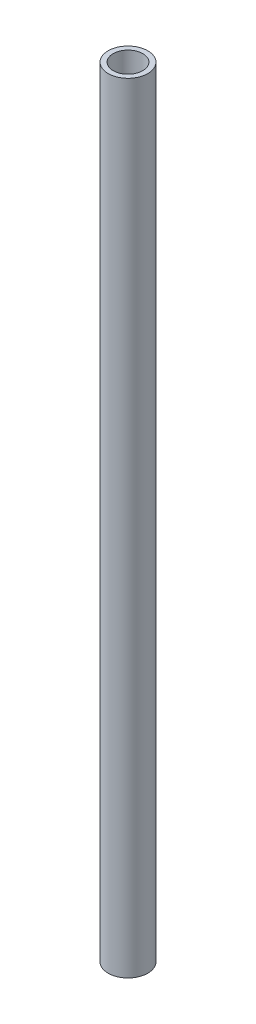
from build123d import *

# Parameters (mm, degrees)
SKETCH1_R           = 12.7
SKETCH1_R_2         = 9.5
BOSS_EXTRUDE1_DEPTH = 500


with BuildPart() as part:
    # Sketch1 → Boss-Extrude1 (new body)
    with BuildSketch(Plane(origin=(0, 0, 0), x_dir=(1, 0, 0), z_dir=(0, 1, 0))):
        with Locations(Location((0, 0, 0), (0, 0, 270))):
            Circle(SKETCH1_R)
        with Locations(Location((0, 0, 0), (0, 0, 270))):
            Circle(SKETCH1_R_2, mode=Mode.SUBTRACT)
    extrude(amount=BOSS_EXTRUDE1_DEPTH)


solid = part.part
